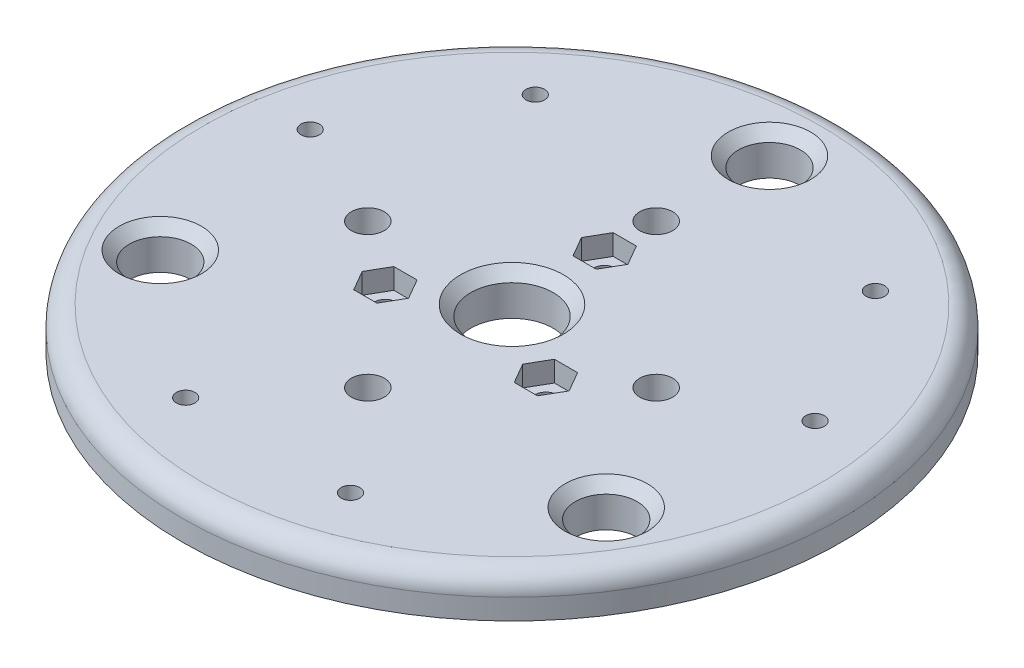
from build123d import *

# Parameters (mm, degrees)
SKETCH_1_R          = 32
SKETCH_1_R_2        = 4
SKETCH_1_R_3        = 3
EXTRUDE_1_DEPTH     = 4
FILLET_1_R          = 2
SKETCH_2_R          = 1.1
CUT_EXTRUDE_1_DEPTH = 46.431266766
SKETCH_3_R          = 1.6
CUT_EXTRUDE_2_DEPTH = 46.431266766
CUT_EXTRUDE_3_DEPTH = 2
CHAMFER_1_SIZE      = 1
SKETCH_5_R          = 0.9
CUT_EXTRUDE_4_DEPTH = 46.431266766


with BuildPart() as part:
    # Эскиз1 → Бобышка-Вытянуть1 (new body)
    with BuildSketch(Plane(origin=(0, 0, 0), x_dir=(1, 0, 0), z_dir=(0, 1, 0))):
        with Locations(Location((0, 0, 0), (0, 0, 270))):
            Circle(SKETCH_1_R)
        with Locations(Location((0, 0, 0), (0, 0, 270))):
            Circle(SKETCH_1_R_2, mode=Mode.SUBTRACT)
        with Locations(Location((0, 25, 0), (0, 0, 270))):
            Circle(SKETCH_1_R_3, mode=Mode.SUBTRACT)
        with Locations(Location((21.650635095, -12.5, 0), (0, 0, 270))):
            Circle(SKETCH_1_R_3, mode=Mode.SUBTRACT)
        with Locations(Location((-21.650635095, -12.5, 0), (0, 0, 270))):
            Circle(SKETCH_1_R_3, mode=Mode.SUBTRACT)
    extrude(amount=EXTRUDE_1_DEPTH)

    # Скругление1
    fillet_1_edges = [part.edges().sort_by_distance(p)[0] for p in [
        (0, 4, -32),
    ]]
    fillet(fillet_1_edges, radius=FILLET_1_R)

    # Эскиз2 → Вырез-Вытянуть1 (cut, through all)
    with BuildSketch(Plane(origin=(0, 4, 0), x_dir=(1, 0, 0), z_dir=(0, 1, 0))):
        with Locations(Location((0, 9, 0), (0, 0, 270))):
            Circle(SKETCH_2_R)
        with Locations(Location((7.794228634, -4.5, 0), (0, 0, 270))):
            Circle(SKETCH_2_R)
        with Locations(Location((-7.794228634, -4.5, 0), (0, 0, 270))):
            Circle(SKETCH_2_R)
    extrude(amount=-CUT_EXTRUDE_1_DEPTH, mode=Mode.SUBTRACT)

    # Эскиз3 → Вырез-Вытянуть2 (cut, through all)
    with BuildSketch(Plane.XZ):
        with Locations(Location((0, 14, 0), (0, 0, 270))):
            Circle(SKETCH_3_R)
        with Locations(Location((14, 0, 0), (0, 0, 270))):
            Circle(SKETCH_3_R)
        with Locations(Location((0, -14, 0), (0, 0, 270))):
            Circle(SKETCH_3_R)
        with Locations(Location((-14, 0, 0), (0, 0, 270))):
            Circle(SKETCH_3_R)
    extrude(amount=-CUT_EXTRUDE_2_DEPTH, mode=Mode.SUBTRACT)

    # Эскиз4 → Вырез-Вытянуть3 (cut)
    with BuildSketch(Plane(origin=(0, 4, 0), x_dir=(1, 0, 0), z_dir=(0, 1, 0))):
        Polygon((5.542562584, -4.5), (6.668395609, -6.45), (8.920061659, -6.45), (10.045894684, -4.5), (8.920061659, -2.55), (6.668395609, -2.55), align=None)
        Polygon((1.125833025, 7.05), (2.25166605, 9), (1.125833025, 10.95), (-1.125833025, 10.95), (-2.25166605, 9), (-1.125833025, 7.05), align=None)
        Polygon((-6.668395609, -2.55), (-8.920061659, -2.55), (-10.045894684, -4.5), (-8.920061659, -6.45), (-6.668395609, -6.45), (-5.542562584, -4.5), align=None)
    extrude(amount=-CUT_EXTRUDE_3_DEPTH, mode=Mode.SUBTRACT)

    # Фаска1
    chamfer_1_edges = [part.edges().sort_by_distance(p)[0] for p in [
        (21.650635095, 4, 9.5),
        (-21.650635095, 4, 9.5),
        (0, 4, -4),
        (0, 4, -28),
    ]]
    chamfer(chamfer_1_edges, length=CHAMFER_1_SIZE)

    # Эскиз5 → Вырез-Вытянуть4 (cut, through all)
    with BuildSketch(Plane(origin=(0, 4, 0), x_dir=(1, 0, 0), z_dir=(0, 1, 0))):
        with Locations(Location((-8, -23.685438565, 0), (0, 0, 270))):
            Circle(SKETCH_5_R)
        with Locations(Location((8, -23.685438565, 0), (0, 0, 270))):
            Circle(SKETCH_5_R)
        with Locations(Location((-16.512191497, 18.770922513, 0), (0, 0, 270))):
            Circle(SKETCH_5_R)
        with Locations(Location((-24.512191497, 4.914516052, 0), (0, 0, 270))):
            Circle(SKETCH_5_R)
        with Locations(Location((24.512191497, 4.914516052, 0), (0, 0, 270))):
            Circle(SKETCH_5_R)
        with Locations(Location((16.512191497, 18.770922513, 0), (0, 0, 270))):
            Circle(SKETCH_5_R)
    extrude(amount=-CUT_EXTRUDE_4_DEPTH, mode=Mode.SUBTRACT)


solid = part.part
